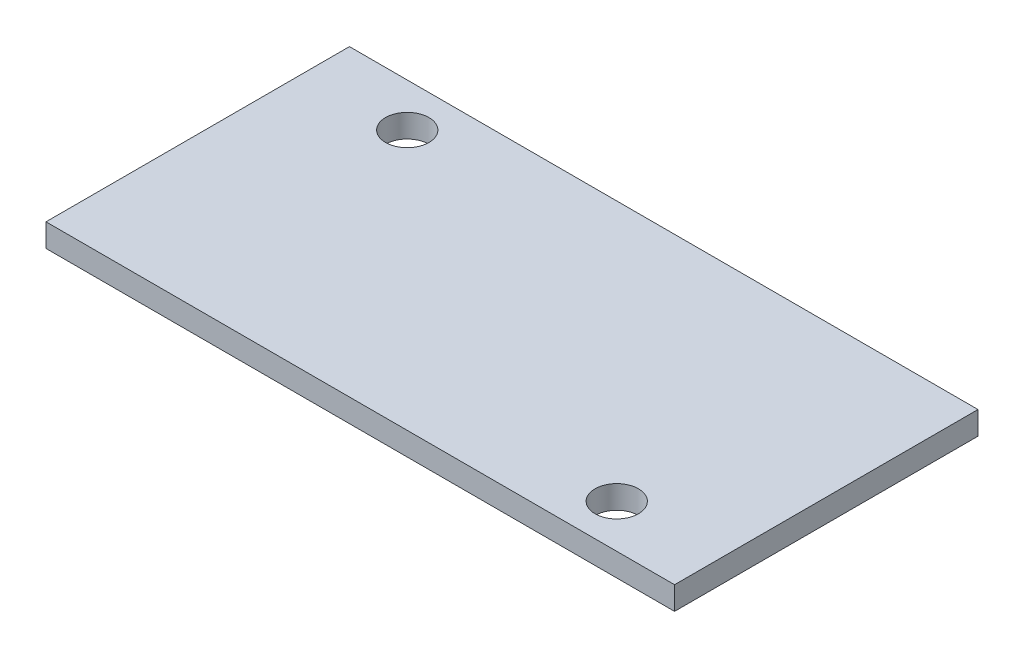
from build123d import *

# Parameters (mm, degrees)
SKETCH_1_W          = 43.5
SKETCH_1_H          = 21
EXTRUDE_1_DEPTH     = 1.6
SKETCH_2_R          = 1.5
CUT_EXTRUDE_1_DEPTH = 10


with BuildPart() as part:
    # 草图1 → 凸台-拉伸1 (new body)
    with BuildSketch(Plane(origin=(0, 0, 0), x_dir=(1, 0, 0), z_dir=(0, 1, 0))):
        Rectangle(SKETCH_1_W, SKETCH_1_H)
    extrude(amount=EXTRUDE_1_DEPTH)

    # 草图2 → 切除-拉伸1 (cut)
    with BuildSketch(Plane(origin=(0, 1.6, 0), x_dir=(1, 0, 0), z_dir=(0, 1, 0))):
        with Locations(Location((-14.75, 7.5, 0), (0, 0, 270))):
            Circle(SKETCH_2_R)
        with Locations(Location((14.75, -7.5, 0), (0, 0, 270))):
            Circle(SKETCH_2_R)
    extrude(amount=-CUT_EXTRUDE_1_DEPTH, mode=Mode.SUBTRACT)


solid = part.part
